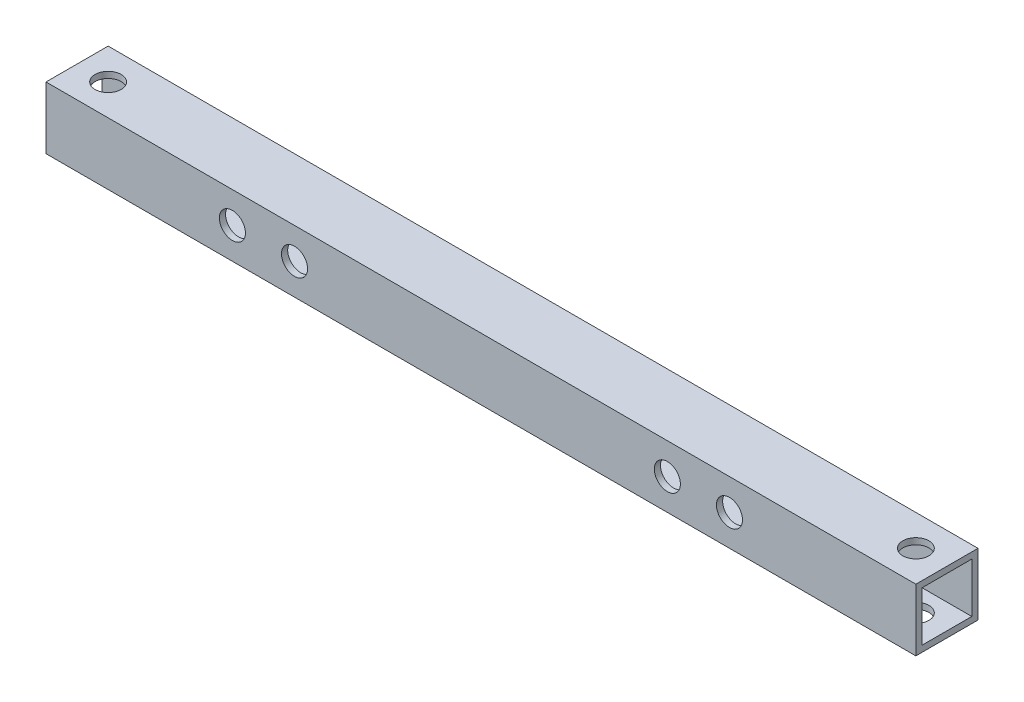
from build123d import *

# Parameters (mm, degrees)
SKETCH_1_W          = 10
SKETCH_1_H          = 10
SKETCH_1_W_2        = 8
SKETCH_1_H_2        = 8
EXTRUDE_1_DEPTH     = 140
SKETCH_2_R          = 2.1
CUT_EXTRUDE_1_DEPTH = 141.445719052
SKETCH_3_R          = 2.1
CUT_EXTRUDE_2_DEPTH = 141.445719052


with BuildPart() as part:
    # ｽｹｯﾁ1 → 押し出し-薄板1 (new body)
    with BuildSketch(Plane(origin=(0, 0, 0), x_dir=(0, 0, -1), z_dir=(1, 0, 0))):
        Rectangle(SKETCH_1_W, SKETCH_1_H)
        Rectangle(SKETCH_1_W_2, SKETCH_1_H_2, mode=Mode.SUBTRACT)
    extrude(amount=EXTRUDE_1_DEPTH)

    # ｽｹｯﾁ2 → ｶｯﾄ - 押し出し1 (cut, through all)
    with BuildSketch(Plane(origin=(0, 5, 0), x_dir=(1, 0, 0), z_dir=(0, 1, 0))):
        with Locations(Location((5, 0, 0), (0, 0, 270))):
            Circle(SKETCH_2_R)
        with Locations(Location((135, 0, 0), (0, 0, 270))):
            Circle(SKETCH_2_R)
    extrude(amount=-CUT_EXTRUDE_1_DEPTH, mode=Mode.SUBTRACT)

    # ｽｹｯﾁ3 → ｶｯﾄ - 押し出し2 (cut, through all)
    with BuildSketch(Plane.XY.offset(5)):
        with Locations((40, 0)):
            Circle(SKETCH_3_R)
        with Locations((30, 0)):
            Circle(SKETCH_3_R)
        with Locations(Location((110, 0, 0), (0, 0, 90))):
            Circle(SKETCH_3_R)
        with Locations(Location((100, 0, 0), (0, 0, 90))):
            Circle(SKETCH_3_R)
    extrude(amount=-CUT_EXTRUDE_2_DEPTH, mode=Mode.SUBTRACT)


solid = part.part
